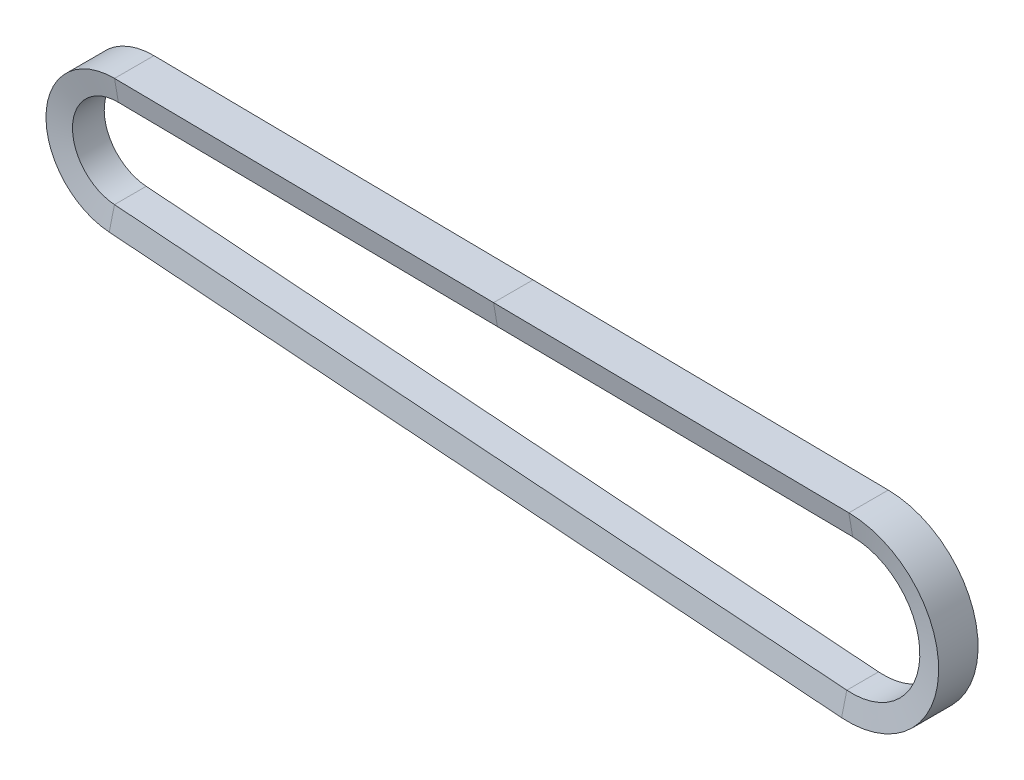
from build123d import *


with BuildPart() as part:
    # Sweep1: sweep along a path in Sketch1
    with BuildLine(Plane.XY) as sweep1_path:
        Line((-83.621246373, 16.138074953), (78.374582486, 14.137693792))
        ThreePointArc((78.374582486, 14.137693792), (93.175376367, -1.508969706), (77.079585122, -15.820052206))
        Line((77.079585122, -15.820052206), (-84.484577949, -3.833755713))
        ThreePointArc((-84.484577949, -3.833755713), (-93.735390463, 6.570708595), (-83.621246373, 16.138074953))
    # Sketch2 → Sweep1 (sweep)
    with BuildSketch(Plane(origin=(0, 0, 0), x_dir=(0, 0, -1), z_dir=(1, 0, 0))):
        Polygon((-3.5, 15.105490552), (3.5, 15.105490552), (4.347703666, 20.105490552), (-4.347703666, 20.105490552), align=None)
    sweep(path=sweep1_path.line)


solid = part.part
